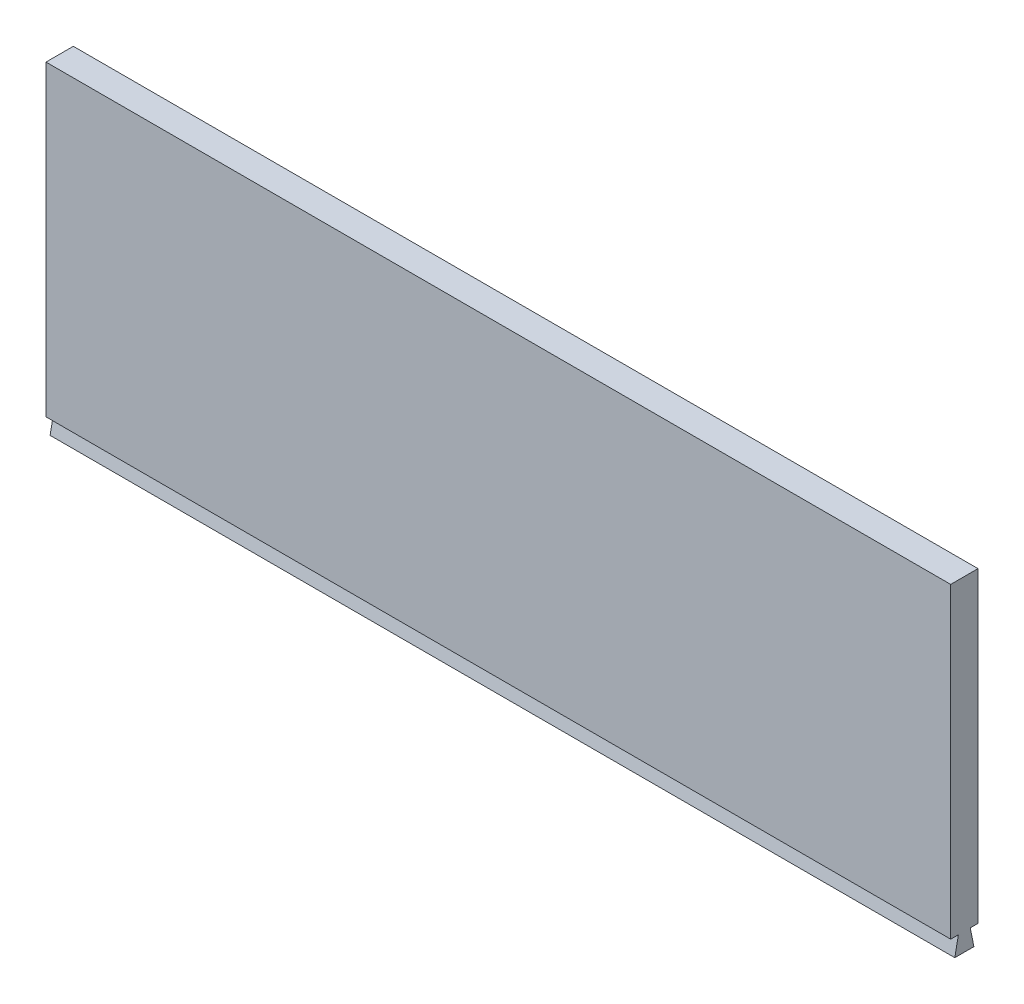
from build123d import *

# Parameters (mm, degrees)
SKETCH1_W           = 265
SKETCH1_H           = 90
BOSS_EXTRUDE1_DEPTH = 8
BOSS_EXTRUDE3_DEPTH = 265


with BuildPart() as part:
    # Sketch1 → Boss-Extrude1 (new body)
    with BuildSketch(Plane.XY):
        with Locations((132.5, 45)):
            Rectangle(SKETCH1_W, SKETCH1_H)
    extrude(amount=BOSS_EXTRUDE1_DEPTH)

    # Sketch3 → Boss-Extrude3 (add, through all)
    with BuildSketch(Plane.ZY):
        Polygon((2.26, 0), (1.2, -5.3), (6.8, -5.3), (5.74, 0), align=None)
    extrude(amount=-BOSS_EXTRUDE3_DEPTH)


solid = part.part
